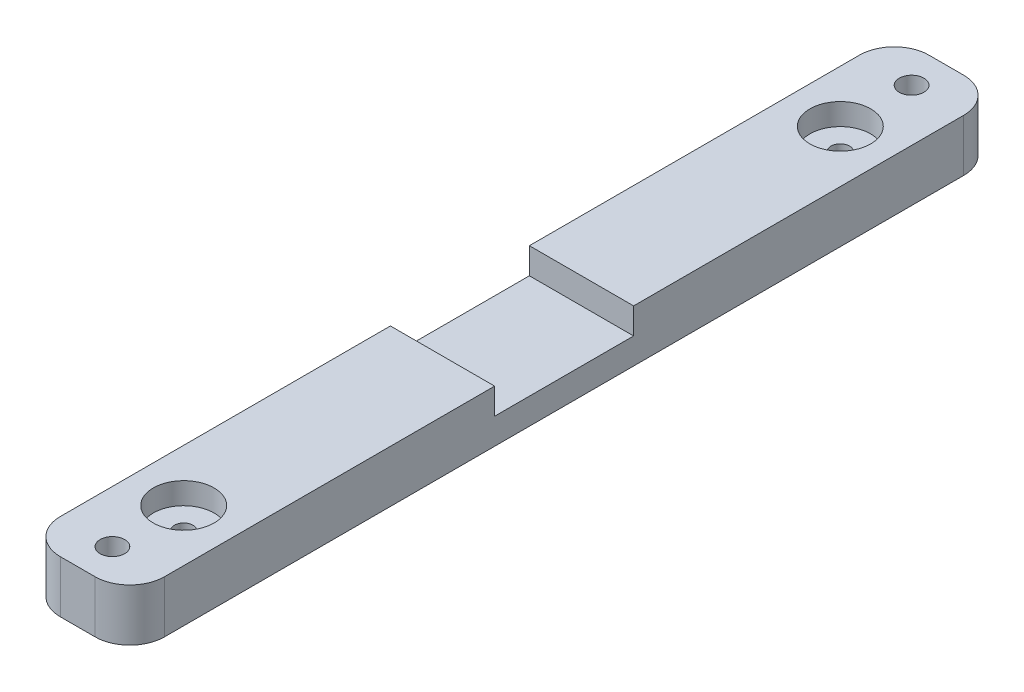
from build123d import *

# Parameters (mm, degrees)
SKETCH1_W             = 19.05
SKETCH1_H             = 9.525
BOSS_EXTRUDE1_DEPTH   = 79.375
SKETCH2_W             = 19.05
SKETCH2_H             = 25.4
CUT_EXTRUDE1_DEPTH    = 4.7625
M3_CLEARANCE_HOLE1_D  = 3.4
SKETCH5_R             = 5.55625
CUT_EXTRUDE2_DEPTH    = 3.96875
F_8_CLEARANCE_HOLE1_D = 4.4958
FILLET1_R             = 6.35


with BuildPart() as part:
    # Sketch1 → Boss-Extrude1 (new, symmetric)
    with BuildSketch(Plane.XY):
        Rectangle(SKETCH1_W, SKETCH1_H)
    extrude(amount=BOSS_EXTRUDE1_DEPTH, both=True)

    # Sketch2 → Cut-Extrude1 (cut)
    with BuildSketch(Plane(origin=(0, 4.7625, 0), x_dir=(1, 0, 0), z_dir=(0, 1, 0))):
        Rectangle(SKETCH2_W, SKETCH2_H)
    extrude(amount=-CUT_EXTRUDE1_DEPTH, mode=Mode.SUBTRACT)

    # M3 Clearance Hole1 (through all)
    with Locations(Plane(origin=(0, 4.7625, 0), x_dir=(1, 0, 0), z_dir=(0, 1, 0))):
        with Locations((0, -60.000000015), (0, 60.000000015)):
            Hole(M3_CLEARANCE_HOLE1_D / 2)

    # Sketch5 → Cut-Extrude2 (cut)
    with BuildSketch(Plane(origin=(0, 4.7625, 0), x_dir=(1, 0, 0), z_dir=(0, 1, 0))):
        with Locations(Location((0, -60.000000015, 0), (0, 0, 270))):
            Circle(SKETCH5_R)
        with Locations(Location((0, 60.000000015, 0), (0, 0, 270))):
            Circle(SKETCH5_R)
    extrude(amount=-CUT_EXTRUDE2_DEPTH, mode=Mode.SUBTRACT)

    # #8 Clearance Hole1 (through all)
    with Locations(Plane(origin=(0, 4.7625, 0), x_dir=(1, 0, 0), z_dir=(0, 1, 0))):
        with Locations((0, -73.025), (0, 73.025)):
            Hole(F_8_CLEARANCE_HOLE1_D / 2)

    # Fillet1
    fillet1_edges = [part.edges().sort_by_distance(p)[0] for p in [
        (-9.525, 0, 79.375),
        (9.525, 0, 79.375),
        (-9.525, 0, -79.375),
        (9.525, 0, -79.375),
    ]]
    fillet(fillet1_edges, radius=FILLET1_R)


solid = part.part
